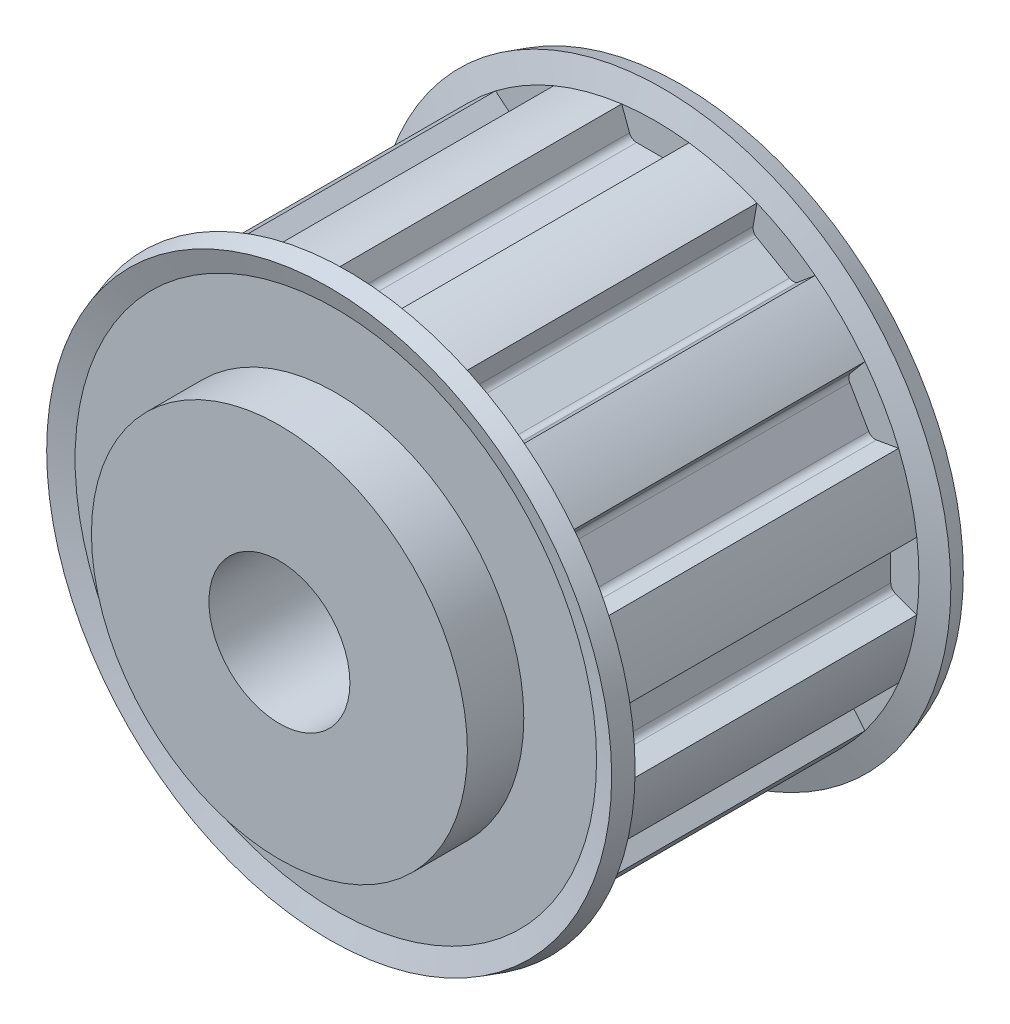
from build123d import *

# Parameters (mm, degrees)
SKETCH1_R        = 17.8054
BASEPULLEY_DEPTH = 20.32
GROOVE_DEPTH     = 10.16
GROOVES_COUNT    = 12
GROOVES_ANGLE    = 330
SKETCH4_W        = 5.08
SKETCH4_H        = 12.7
BORSKE_R         = 4.7625
BORE_DEPTH       = 39.633634572


with BuildPart() as part:
    # Sketch1 → BasePulley (new body)
    with BuildSketch(Plane.XY):
        Circle(SKETCH1_R)
    extrude(amount=-BASEPULLEY_DEPTH)

    # Sketch2 → Flange (revolve)
    with BuildSketch(Plane(origin=(0, 0, 0), x_dir=(0, 0, -1), z_dir=(1, 0, 0)), mode=Mode.PRIVATE) as flange_sk:
        Polygon((20.32, 17.8054), (20.824761355, 19.4564), (22.039268395, 19.085087935), (21.59, 17.615597228), (21.59, 0), (-1.27, 0), (-1.27, 17.615597228), (-1.719268395, 19.085087935), (-0.504761355, 19.4564), (0, 17.8054), align=None)
    revolve(flange_sk.sketch.rotate(Axis((0, 0, 0), (0, 0, -1)), 90), axis=Axis((0, 0, 0), (0, 0, -1)))

    # Sketch3 → Groove (cut, symmetric)
    with BuildSketch(Plane.XY.offset(-10.16)):
        with BuildLine():
            Line((-2.3241, 17.8054), (-2.3241, 43.2054))
            Line((-2.3241, 43.2054), (2.3241, 43.2054))
            Line((2.3241, 43.2054), (2.3241, 17.8054))
            Line((2.3241, 17.8054), (1.752395126, 16.234653767))
            ThreePointArc((1.752395126, 16.234653767), (1.566408104, 15.992270762), (1.275031274, 15.9004))
            Line((1.275031274, 15.9004), (-1.275031274, 15.9004))
            ThreePointArc((-1.275031274, 15.9004), (-1.566408104, 15.992270762), (-1.752395126, 16.234653767))
            Line((-1.752395126, 16.234653767), (-2.3241, 17.8054))
        make_face()
    groove = extrude(amount=GROOVE_DEPTH, both=True, mode=Mode.SUBTRACT)

    # Grooves: Groove ×12 about axis
    grooves_axis = Axis((0, 0, -20.32), (0, 0, 1))
    for i in range(1, GROOVES_COUNT):
        add(groove.rotate(grooves_axis, i * GROOVES_ANGLE / (GROOVES_COUNT - 1)), mode=Mode.SUBTRACT)

    # Sketch4 → BaseHub (revolve)
    with BuildSketch(Plane(origin=(0, 0, 0), x_dir=(0, 0, -1), z_dir=(1, 0, 0)), mode=Mode.PRIVATE) as basehub_sk:
        with Locations((-2.54, 6.35)):
            Rectangle(SKETCH4_W, SKETCH4_H)
    revolve(basehub_sk.sketch.rotate(Axis((0, 0, 0), (0, 0, -1)), 277.328312747), axis=Axis((0, 0, 0), (0, 0, -1)))

    # BorSke → Bore (cut, through all)
    with BuildSketch(Plane.XY.offset(5.08)):
        Circle(BORSKE_R)
    extrude(amount=-BORE_DEPTH, mode=Mode.SUBTRACT)


solid = part.part
